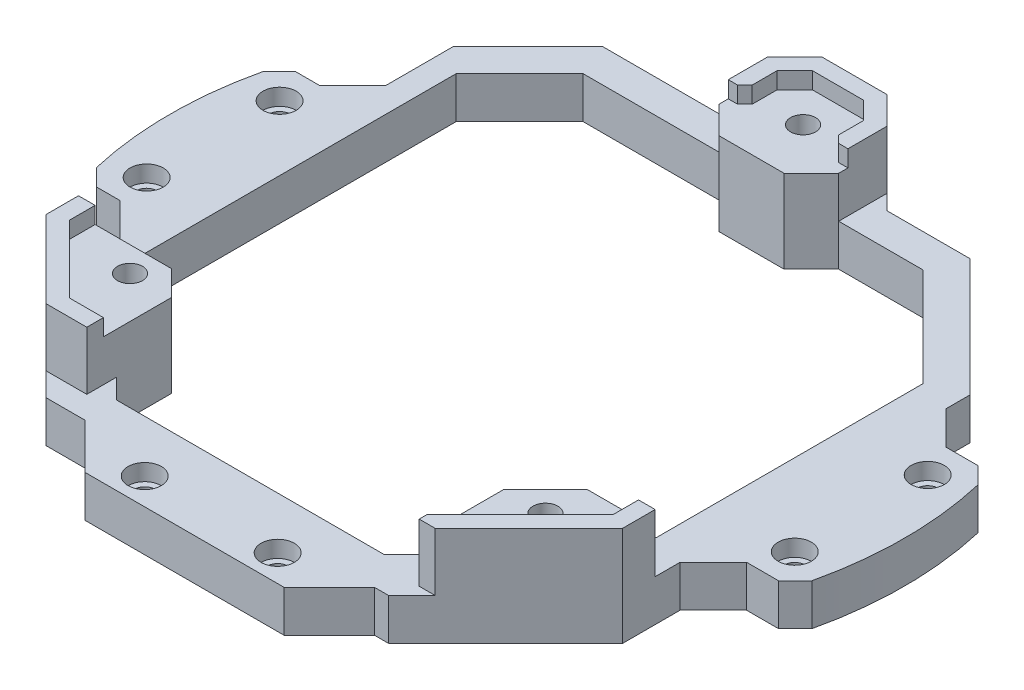
from build123d import *

# Parameters (mm, degrees)
SKETCH_2_R          = 1.5
EXTRUDE_2_DEPTH     = 5
EXTRUDE_2_2_DEPTH   = 5
EXTRUDE_2_3_DEPTH   = 5
EXTRUDE_5_DEPTH     = 2
EXTRUDE_6_DEPTH     = 2
EXTRUDE_7_DEPTH     = 5
SKETCH_11_R         = 1.25
EXTRUDE_8_DEPTH     = 5
CHAMFER_1_SIZE      = 4
SKETCH_12_R         = 2
CUT_EXTRUDE_1_DEPTH = 2


with BuildPart() as part:
    # Эскиз2 → Бобышка-Вытянуть2 (new body)
    with BuildSketch(Plane(origin=(0, 0, 0), x_dir=(1, 0, 0), z_dir=(0, 1, 0))):
        Polygon((7.2, 29.088730163), (7.2, 34.911269837), (3.911269837, 38.2), (-3.911269837, 38.2), (-7.2, 34.911269837), (-7.2, 29.088730163), (-3.911269837, 25.8), (3.911269837, 25.8), align=None)
        with Locations(Location((0, 32, 0), (0, 0, 270))):
            Circle(SKETCH_2_R, mode=Mode.SUBTRACT)
    extrude(amount=-EXTRUDE_2_DEPTH)



with BuildPart() as body_2:
    # Эскиз2 → Extrude 2 2 (new body)
    with BuildSketch(Plane(origin=(0, 0, 0), x_dir=(1, 0, 0), z_dir=(0, 1, 0))):
        Polygon((20, -24), (20, -33), (20, -34.2), (21.911269837, -34.2), (33.2, -22.911269837), (33.2, -19), (25, -19), align=None)
        with Locations(Location((25, -24, 0), (0, 0, 270))):
            Circle(SKETCH_2_R, mode=Mode.SUBTRACT)
    extrude(amount=-EXTRUDE_2_2_DEPTH)

    # Эскиз5 → Бобышка-Вытянуть6 (add)
    with BuildSketch(Plane(origin=(0, 0, 0), x_dir=(1, 0, 0), z_dir=(0, 1, 0))):
        Polygon((31.2, -19), (33.2, -19), (33.2, -22.911269837), (21.911269837, -34.2), (20, -34.2), (20, -33.282842712), (31.2, -22.082842712), align=None)
    extrude(amount=EXTRUDE_6_DEPTH)


with BuildPart() as body_3:
    # Эскиз2 → Extrude 2 3 (new body)
    with BuildSketch(Plane(origin=(0, 0, 0), x_dir=(1, 0, 0), z_dir=(0, 1, 0))):
        Polygon((-20, -34.2), (-20, -24), (-23, -21), (-34.2, -21), (-34.2, -24.911269837), (-24.911269837, -34.2), align=None)
        with Locations(Location((-25, -24, 0), (0, 0, 270))):
            Circle(SKETCH_2_R, mode=Mode.SUBTRACT)
    extrude(amount=-EXTRUDE_2_3_DEPTH)


with BuildPart() as part_1:
    add(part.part)

    add(body_3.part)  # Бобышка-Вытянуть5 merges body 3
    # Эскиз3 → Бобышка-Вытянуть5 (add)
    with BuildSketch(Plane(origin=(0, 0, 0), x_dir=(1, 0, 0), z_dir=(0, 1, 0))):
        Polygon((7.2, 30.2), (7.2, 34.911269837), (3.911269837, 38.2), (-3.911269837, 38.2), (-7.2, 34.911269837), (-7.2, 30.2), (-6.082842712, 30.2), (-5.2, 31.082842712), (-5.2, 34.082842712), (-3.082842712, 36.2), (3.082842712, 36.2), (5.2, 34.082842712), (5.2, 31.082842712), (6.082842712, 30.2), align=None)
        Polygon((-24.911269837, -34.2), (-20, -34.2), (-20, -32.2), (-24.082842712, -32.2), (-32.2, -24.082842712), (-32.2, -21), (-34.2, -21), (-34.2, -24.911269837), align=None)
    extrude(amount=EXTRUDE_5_DEPTH)


    add(body_2.part)  # Бобышка-Вытянуть7 merges body 2
    # Эскиз6 → Бобышка-Вытянуть7 (add)
    with BuildSketch(Plane.XZ.offset(5)):
        Polygon((-7.2, -34.911269837), (-3.911269837, -38.2), (3.911269837, -38.2), (7.2, -34.911269837), (9.022539674, -33.088730163), (19.022539674, -33.088730163), (33.2, -18.911269837), (33.2, 19), (33.2, 22.911269837), (21.911269837, 34.2), (19.111269837, 37), (13, 37), (-8, 37), (-22.111269837, 37), (-24.911269837, 34.2), (-34.2, 24.911269837), (-34.2, 21), (-34.2, -24.088730163), (-25.2, -33.088730163), (-9.022539674, -33.088730163), align=None)
        Polygon((7.2, -29.088730163), (3.911269837, -25.8), (-3.911269837, -25.8), (-7.2, -29.088730163), (-23.543145751, -29.088730163), (-31.2, -21.431875913), (-31.2, 19.425988463), (-29.625988463, 21), (-23, 21), (-20, 24), (-20, 30.625988463), (-17.625988463, 33), (14.625988463, 33), (20, 27.625988463), (20, 24), (25, 19), (29.2, 14.8), (29.2, -17.254415588), (17.365685425, -29.088730163), align=None, mode=Mode.SUBTRACT)
    extrude(amount=EXTRUDE_7_DEPTH)

    # Эскиз11 → Бобышка-Вытянуть8 (add)
    # profile 1 of 3: a face of its own
    with BuildSketch(Plane(origin=(0, -5, 0), x_dir=(1, 0, 0), z_dir=(0, 1, 0))):
        with BuildLine():
            Line((41.053919682, 12), (33.2, 12))
            Line((33.2, 12), (33.2, -12))
            Line((33.2, -12), (41.053919682, -12))
            Line((41.053919682, -12), (43.053919682, -10))
            ThreePointArc((43.053919682, -10), (44.2, 0), (43.053919682, 10))
            Line((43.053919682, 10), (41.053919682, 12))
        make_face()
        with Locations(Location((39, 8, 0), (0, 0, 270))):
            Circle(SKETCH_11_R, mode=Mode.SUBTRACT)
        with Locations(Location((39, -8, 0), (0, 0, 270))):
            Circle(SKETCH_11_R, mode=Mode.SUBTRACT)
    # profile 2 of 3: a face of its own
    with BuildSketch(Plane(origin=(0, -5, 0), x_dir=(1, 0, 0), z_dir=(0, 1, 0))):
        with BuildLine():
            Line((-41.053919682, 12), (-34.2, 12))
            Line((-34.2, 12), (-34.2, -12))
            Line((-34.2, -12), (-41.053919682, -12))
            Line((-41.053919682, -12), (-43.053919682, -10))
            ThreePointArc((-43.053919682, -10), (-44.2, 0), (-43.053919682, 10))
            Line((-43.053919682, 10), (-41.053919682, 12))
        make_face()
        with Locations(Location((-39, 8, 0), (0, 0, 90))):
            Circle(SKETCH_11_R, mode=Mode.SUBTRACT)
        with Locations(Location((-39, -8, 0), (0, 0, 90))):
            Circle(SKETCH_11_R, mode=Mode.SUBTRACT)
    # profile 3 of 3: a face of its own
    with BuildSketch(Plane(origin=(0, -5, 0), x_dir=(1, 0, 0), z_dir=(0, 1, 0))):
        Polygon((-12, -42.44), (12, -42.44), (17.44, -37), (-17.44, -37), align=None)
        with Locations(Location((8, -39.23, 0), (0, 0, 270))):
            Circle(SKETCH_11_R, mode=Mode.SUBTRACT)
        with Locations(Location((-8, -39.23, 0), (0, 0, 90))):
            Circle(SKETCH_11_R, mode=Mode.SUBTRACT)
    extrude(amount=-EXTRUDE_8_DEPTH)

    # Фаска1
    chamfer_1_edges = [part_1.edges().sort_by_distance(p)[0] for p in [
        (33.2, -7.5, 12),
        (33.2, -7.5, -12),
        (-34.2, -7.5, -12),
        (-34.2, -7.5, 12),
    ]]
    chamfer(chamfer_1_edges, length=CHAMFER_1_SIZE)

    # Эскиз12 → Вырез-Вытянуть1 (cut)
    with BuildSketch(Plane(origin=(0, -5, 0), x_dir=(1, 0, 0), z_dir=(0, 1, 0))):
        with Locations(Location((-39, 8, 0), (0, 0, 270))):
            Circle(SKETCH_12_R)
        with Locations(Location((-39, -8, 0), (0, 0, 270))):
            Circle(SKETCH_12_R)
        with Locations(Location((39, 8, 0), (0, 0, 270))):
            Circle(SKETCH_12_R)
        with Locations(Location((39, -8, 0), (0, 0, 270))):
            Circle(SKETCH_12_R)
        with Locations(Location((8, -39.23, 0), (0, 0, 270))):
            Circle(SKETCH_12_R)
        with Locations(Location((-8, -39.23, 0), (0, 0, 270))):
            Circle(SKETCH_12_R)
    extrude(amount=-CUT_EXTRUDE_1_DEPTH, mode=Mode.SUBTRACT)


solid = part_1.part
